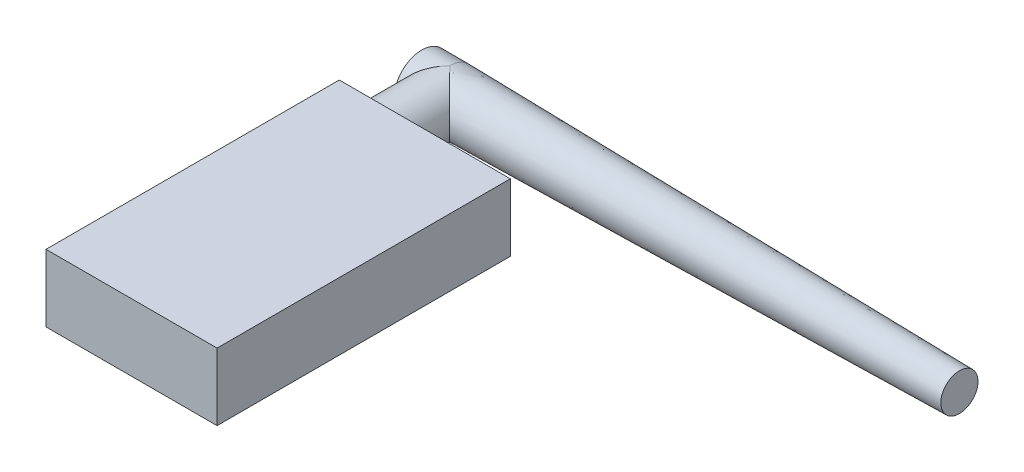
from build123d import *

# Parameters (mm, degrees)
SCHIZZO1_W                             = 28
SCHIZZO1_H                             = 48
ESTRUSIONE_ESTRUSIONE1_DEPTH           = 11
SCHIZZO3_R                             = 4.5
ESTRUSIONE_ESTRUSIONE2_DEPTH           = 12
SCHIZZO4_R                             = 4.5
ESTRUSIONE_ESTRUSIONE3_DEPTH           = 83.5
ESTRUSIONE_ESTRUSIONE3_TAPER           = 1
ESTRUSIONE_ESTRUSIONE3_OTHER_WAY_DEPTH = 4.5


with BuildPart() as part:
    # Schizzo1 → Estrusione-Estrusione1 (new body)
    with BuildSketch(Plane(origin=(0, 0, 0), x_dir=(1, 0, 0), z_dir=(0, 1, 0))):
        Rectangle(SCHIZZO1_W, SCHIZZO1_H)
    extrude(amount=ESTRUSIONE_ESTRUSIONE1_DEPTH)

    # Schizzo3 → Estrusione-Estrusione2 (add)
    with BuildSketch(Plane(origin=(0, 0, -24), x_dir=(-1, 0, 0), z_dir=(0, 0, -1))):
        with Locations(Location((8, 5.5, 0), (0, 0, 180))):
            Circle(SCHIZZO3_R)
    extrude(amount=ESTRUSIONE_ESTRUSIONE2_DEPTH)

    # Schizzo4 → Estrusione-Estrusione3 (add)
    with BuildSketch(Plane(origin=(-8, 0, 0), x_dir=(0, 0, -1), z_dir=(1, 0, 0))):
        with Locations((36, 5.5)):
            Circle(SCHIZZO4_R)
    extrude(amount=ESTRUSIONE_ESTRUSIONE3_DEPTH, taper=ESTRUSIONE_ESTRUSIONE3_TAPER)

    # Schizzo4 → Estrusione-Estrusione3 other way (add)
    with BuildSketch(Plane(origin=(-8, 0, 0), x_dir=(0, 0, -1), z_dir=(1, 0, 0))):
        with Locations((36, 5.5)):
            Circle(SCHIZZO4_R)
    extrude(amount=-ESTRUSIONE_ESTRUSIONE3_OTHER_WAY_DEPTH)


solid = part.part
